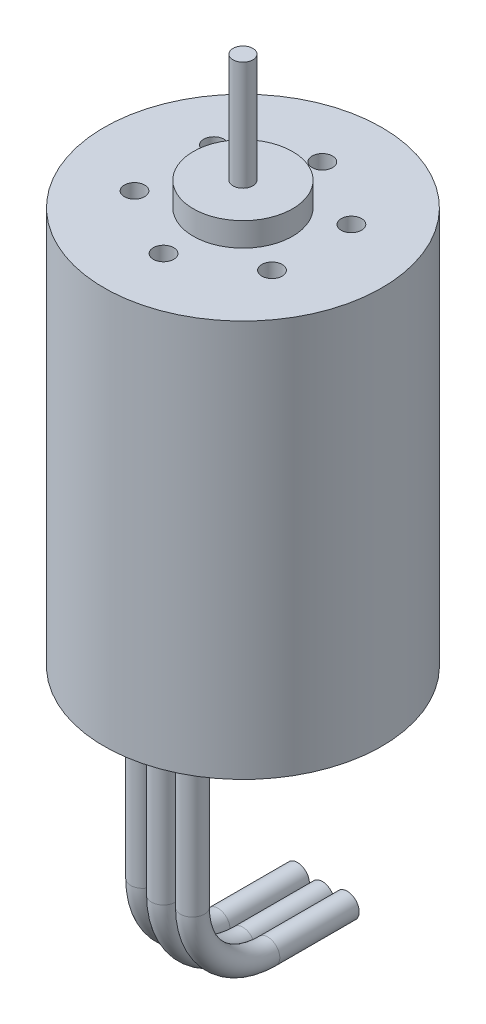
from build123d import *

# Parameters (mm, degrees)
CIRPATTERN1_COUNT = 6
SKETCH4_R         = 1.2065


with BuildPart() as part:
    # Sketch1 → Revolve1 (revolve)
    with BuildSketch(Plane.XY, mode=Mode.PRIVATE) as revolve1_sk:
        Polygon((0, 55.8), (1, 55.8), (1, 44.8), (5, 44.8), (5, 42.4), (14, 42.4), (14, 2.4), (5, 2.4), (5, 0), (0, 0), align=None)
    revolve(revolve1_sk.sketch.rotate(Axis((0, 0, 0), (0, 1, 0)), 90), axis=Axis((0, 0, 0), (0, 1, 0)))

    # Sketch2 → M2.5x0.45 Tapped Hole1 (revolve, cut)
    with BuildSketch(Plane(origin=(0, 42.4, -8), x_dir=(0, 0, 1), z_dir=(1, 0, 0))):
        Polygon((0, 0), (0, 4.615874135), (1.025, 3.999992), (1.025, 0), align=None)
    m2_5x0_45_tapped_hole1 = revolve(axis=Axis((0, 48.75, -8), (0, -1, 0)), mode=Mode.SUBTRACT)

    # CirPattern1: M2.5x0.45 Tapped Hole1 ×6 about axis
    cirpattern1_axis = Axis((0, 0, 0), (0, 1, 0))
    for i in range(1, CIRPATTERN1_COUNT):
        add(m2_5x0_45_tapped_hole1.rotate(cirpattern1_axis, i * 360 / CIRPATTERN1_COUNT), mode=Mode.SUBTRACT)

    # Sweep1: sweep along a path in Sketch5
    with BuildLine(Plane(origin=(0, 0, 0), x_dir=(0, 0, -1), z_dir=(1, 0, 0))) as sweep1_path:
        Line((-8, 2.4), (-8, -13.6))
        ThreePointArc((-8, -13.6), (-5.656854249, -19.256854249), (0, -21.6))
        Line((0, -21.6), (8, -21.6))
    # Sketch4 → Sweep1 (sweep)
    with BuildSketch(Plane(origin=(0, 2.4, 0), x_dir=(-1, 0, 0), z_dir=(0, -1, 0))):
        with Locations((-2.507789784, -7.596775)):
            Circle(SKETCH4_R)
        with Locations((0, -8)):
            Circle(SKETCH4_R)
        with Locations((2.507789784, -7.596775)):
            Circle(SKETCH4_R)
    sweep(path=sweep1_path.line)


solid = part.part
